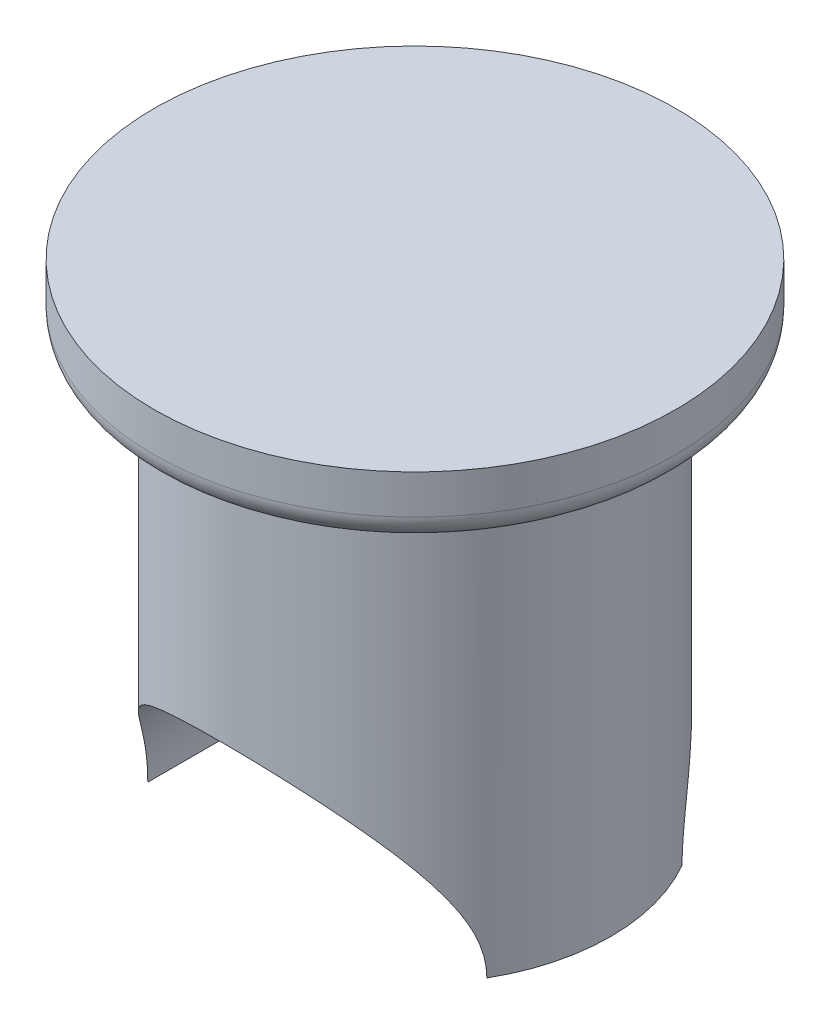
from build123d import *

# Parameters (mm, degrees)
SKETCH2_R               = 15
BOSS_EXTRUDE1_DEPTH     = 32.5
CUT_EXTRUDE1_DEPTH      = 50
CUT_EXTRUDE1_DEPTH_BACK = 50
SKETCH3_R               = 13
SKETCH5_R               = 20
BOSS_EXTRUDE2_DEPTH     = 5
FILLET1_R               = 2


with BuildPart() as part:
    # Sketch2 → Boss-Extrude1 (new body)
    with BuildSketch(Plane(origin=(0, 0, 0), x_dir=(1, 0, 0), z_dir=(0, 1, 0))):
        Circle(SKETCH2_R)
    extrude(amount=BOSS_EXTRUDE1_DEPTH)

    # Sketch3 → Cut-Extrude1 (cut, two sides: drawn at the far end of the back side and taken through both)
    with BuildSketch(Plane.XY.offset(-CUT_EXTRUDE1_DEPTH_BACK)):
        Circle(SKETCH3_R)
    extrude(amount=CUT_EXTRUDE1_DEPTH + CUT_EXTRUDE1_DEPTH_BACK, mode=Mode.SUBTRACT)

    # Sketch5 → Boss-Extrude2 (add)
    with BuildSketch(Plane(origin=(0, 32.5, 0), x_dir=(1, 0, 0), z_dir=(0, 1, 0))):
        Circle(SKETCH5_R)
    extrude(amount=BOSS_EXTRUDE2_DEPTH)

    # Fillet1
    fillet1_edges = [part.edges().sort_by_distance(p)[0] for p in [
        (-20, 32.5, 0),
        (-15, 32.5, 0),
    ]]
    fillet(fillet1_edges, radius=FILLET1_R)


solid = part.part
